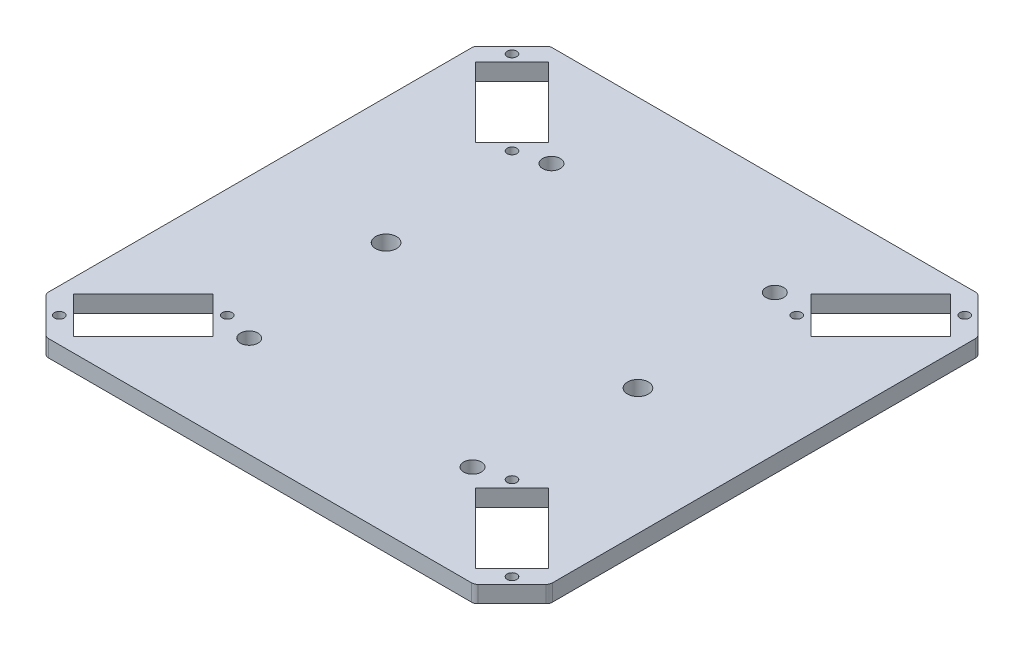
from build123d import *

# Parameters (mm, degrees)
SKETCH1_R           = 1.15
SKETCH1_R_2         = 2.5
SKETCH1_R_3         = 2.1
BOSS_EXTRUDE1_DEPTH = 4
FILLET1_R           = 1.5


with BuildPart() as part:
    # Sketch1 → Boss-Extrude1 (new body)
    with BuildSketch(Plane(origin=(0, 0, 0), x_dir=(1, 0, 0), z_dir=(0, 1, 0))):
        Polygon((-60, 51), (-60, -51), (-51, -60), (51, -60), (60, -51), (60, 51), (51, 60), (-51, 60), align=None)
        with Locations(Location((-53.918881682, 53.918881682, 0), (0, 0, 270))):
            Circle(SKETCH1_R, mode=Mode.SUBTRACT)
        with Locations(Location((-33.907759774, 33.907759774, 0), (0, 0, 270))):
            Circle(SKETCH1_R, mode=Mode.SUBTRACT)
        with Locations(Location((33.907759774, 33.907759774, 0), (0, 0, 90))):
            Circle(SKETCH1_R, mode=Mode.SUBTRACT)
        with Locations(Location((53.918881682, 53.918881682, 0), (0, 0, 90))):
            Circle(SKETCH1_R, mode=Mode.SUBTRACT)
        with Locations(Location((-53.918881682, -53.918881682, 0), (0, 0, 270))):
            Circle(SKETCH1_R, mode=Mode.SUBTRACT)
        with Locations(Location((-33.907759774, -33.907759774, 0), (0, 0, 270))):
            Circle(SKETCH1_R, mode=Mode.SUBTRACT)
        with Locations(Location((53.918881682, -53.918881682, 0), (0, 0, 90))):
            Circle(SKETCH1_R, mode=Mode.SUBTRACT)
        with Locations(Location((33.907759774, -33.907759774, 0), (0, 0, 90))):
            Circle(SKETCH1_R, mode=Mode.SUBTRACT)
        with Locations(Location((-30, 0, 0), (0, 0, 270))):
            Circle(SKETCH1_R_2, mode=Mode.SUBTRACT)
        with Locations(Location((30, 0, 0), (0, 0, 270))):
            Circle(SKETCH1_R_2, mode=Mode.SUBTRACT)
        with Locations(Location((26.599203711, 36, 0), (0, 0, 270))):
            Circle(SKETCH1_R_3, mode=Mode.SUBTRACT)
        with Locations(Location((26.599203711, -36, 0), (0, 0, 270))):
            Circle(SKETCH1_R_3, mode=Mode.SUBTRACT)
        with Locations(Location((-26.599203711, -36, 0), (0, 0, 270))):
            Circle(SKETCH1_R_3, mode=Mode.SUBTRACT)
        with Locations(Location((-26.599203711, 36, 0), (0, 0, 270))):
            Circle(SKETCH1_R_3, mode=Mode.SUBTRACT)
        Polygon((-56.570532111, 47.873118703), (-47.873118703, 56.570532111), (-31.256109345, 39.953522753), (-39.953522753, 31.256109345), align=None, mode=Mode.SUBTRACT)
        Polygon((39.953522753, 31.256109345), (31.256109345, 39.953522753), (47.873118703, 56.570532111), (56.570532111, 47.873118703), align=None, mode=Mode.SUBTRACT)
        Polygon((-47.873118703, -56.570532111), (-56.570532111, -47.873118703), (-39.953522753, -31.256109345), (-31.256109345, -39.953522753), align=None, mode=Mode.SUBTRACT)
        Polygon((47.873118703, -56.570532111), (56.570532111, -47.873118703), (39.953522753, -31.256109345), (31.256109345, -39.953522753), align=None, mode=Mode.SUBTRACT)
    extrude(amount=BOSS_EXTRUDE1_DEPTH)

    # Fillet1
    fillet1_edges = [part.edges().sort_by_distance(p)[0] for p in [
        (51, 2, -60),
        (60, 2, -51),
        (60, 2, 51),
        (51, 2, 60),
        (-51, 2, 60),
        (-60, 2, 51),
        (-60, 2, -51),
        (-51, 2, -60),
    ]]
    fillet(fillet1_edges, radius=FILLET1_R)


solid = part.part
